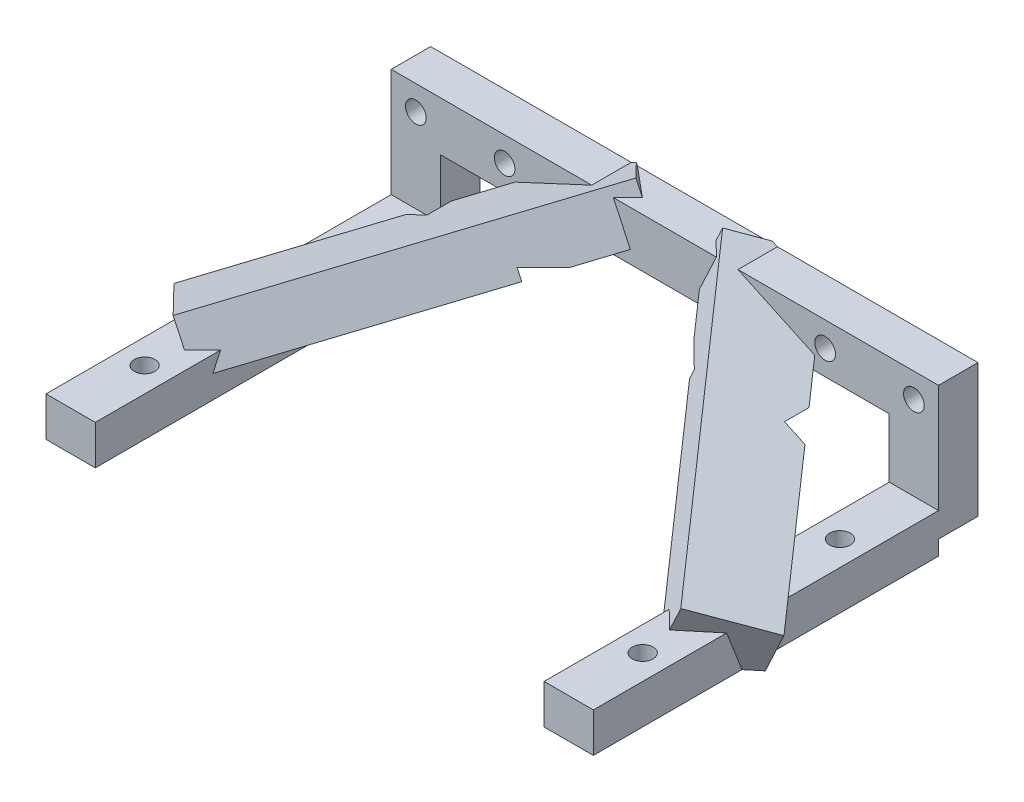
from build123d import *

# Parameters (mm, degrees)
SKETCH_1_W          = 10
SKETCH_1_H          = 70
SKETCH_1_R          = 2.1
EXTRUDE_1_DEPTH     = 8
EXTRUDE_1_2_DEPTH   = 8
SKETCH_2_W          = 10
SKETCH_2_H          = 8
EXTRUDE_2_DEPTH     = 30
SKETCH_4_W          = 8
SKETCH_4_H          = 10
EXTRUDE_3_DEPTH     = 97
SKETCH_6_R          = 2.1
CUT_EXTRUDE_1_DEPTH = 101.320735643
EXTRUDE_4_DEPTH     = 10
SKETCH_11_W         = 111
SKETCH_11_H         = 6
CUT_EXTRUDE_3_DEPTH = 86.153989901
CUT_EXTRUDE_5_DEPTH = 20
SKETCH_13_W         = 8
SKETCH_13_H         = 3
CUT_EXTRUDE_7_DEPTH = 130.217721636
SKETCH_14_W         = 130
SKETCH_14_H         = 5
CUT_EXTRUDE_8_DEPTH = 105.816357447


with BuildPart() as part:
    # 草图1 → 凸台-拉伸1 (new body)
    with BuildSketch(Plane(origin=(0, 0, 0), x_dir=(1, 0, 0), z_dir=(0, 1, 0))):
        with Locations((-50.5, 0)):
            Rectangle(SKETCH_1_W, SKETCH_1_H)
        with Locations(Location((-50.5, 20, 0), (0, 0, 270))):
            Circle(SKETCH_1_R, mode=Mode.SUBTRACT)
        with Locations(Location((-50.5, -20, 0), (0, 0, 90))):
            Circle(SKETCH_1_R, mode=Mode.SUBTRACT)
    extrude(amount=EXTRUDE_1_DEPTH)



with BuildPart() as body_2:
    # 草图1 → Extrude 1 2 (new body)
    with BuildSketch(Plane(origin=(0, 0, 0), x_dir=(1, 0, 0), z_dir=(0, 1, 0))):
        with Locations((50.5, 0)):
            Rectangle(SKETCH_1_W, SKETCH_1_H)
        with Locations(Location((50.5, -20, 0), (0, 0, 270))):
            Circle(SKETCH_1_R, mode=Mode.SUBTRACT)
        with Locations(Location((50.5, 20, 0), (0, 0, 90))):
            Circle(SKETCH_1_R, mode=Mode.SUBTRACT)
    extrude(amount=EXTRUDE_1_2_DEPTH)


with BuildPart() as part_1:
    add(part.part)

    add(body_2.part)  # 凸台-拉伸2 merges body 2
    # 草图2 → 凸台-拉伸2 (add)
    with BuildSketch(Plane(origin=(0, 0, 0), x_dir=(1, 0, 0), z_dir=(0, 1, 0))):
        with Locations((-50.5, 39)):
            Rectangle(SKETCH_2_W, SKETCH_2_H)
        with Locations((50.5, 39)):
            Rectangle(SKETCH_2_W, SKETCH_2_H)
    extrude(amount=EXTRUDE_2_DEPTH)

    # 草图4 → 凸台-拉伸3 (add)
    with BuildSketch(Plane.ZY.offset(-45.5)):
        with Locations((-39, 25)):
            Rectangle(SKETCH_4_W, SKETCH_4_H)
    extrude(amount=EXTRUDE_3_DEPTH)

    # 草图6 → 切除-拉伸1 (cut, through all)
    with BuildSketch(Plane(origin=(0, 0, -43), x_dir=(-1, 0, 0), z_dir=(0, 0, -1))):
        with Locations((-50.5, 25)):
            Circle(SKETCH_6_R)
        with Locations((-32.5, 25)):
            Circle(SKETCH_6_R)
        with Locations((32.5, 25)):
            Circle(SKETCH_6_R)
        with Locations((50.5, 25)):
            Circle(SKETCH_6_R)
    extrude(amount=-CUT_EXTRUDE_1_DEPTH, mode=Mode.SUBTRACT)

    # 草图9 → 凸台-拉伸4 (add)
    with BuildSketch(Plane(origin=(-9.912643831, 21.257733297, 0), x_dir=(0, 0, 1), z_dir=(-0.4226182617407003, 0.9063077870366496, 0))):
        Polygon((13.243149515, -41.193317821), (-37.922770357, 5.903700872), (-48.463730846, -5.547935659), (2.702189027, -52.644954352), align=None)
    extrude_4 = extrude(amount=EXTRUDE_4_DEPTH)

    # 镜向2: 凸台-拉伸4 across plane
    add(extrude_4.mirror(Plane(origin=(0, 0, 0), x_dir=(0, 0, 1), z_dir=(1, 0, 0))))

    # 草图11 → 切除-拉伸3 (cut, through all)
    with BuildSketch(Plane(origin=(0, 0, 0), x_dir=(1, 0, 0), z_dir=(0, 1, 0))):
        with Locations((0, 46)):
            Rectangle(SKETCH_11_W, SKETCH_11_H)
    extrude(amount=CUT_EXTRUDE_3_DEPTH, mode=Mode.SUBTRACT)

    # 草图12 → 切除-拉伸5 (cut)
    with BuildSketch(Plane(origin=(0, 0, -43), x_dir=(-1, 0, 0), z_dir=(0, 0, -1))):
        Polygon((-45.5, 20), (-45.5, 0), (-60, 0), (-60, -5), (60, -5), (60, 0), (45.5, 0), (45.5, 20), align=None)
    extrude(amount=-CUT_EXTRUDE_5_DEPTH, mode=Mode.SUBTRACT)

    # 草图13 → 切除-拉伸7 (cut, through all)
    with BuildSketch(Plane.ZY.offset(55.5)):
        with Locations((-39, 1.5)):
            Rectangle(SKETCH_13_W, SKETCH_13_H)
    extrude(amount=-CUT_EXTRUDE_7_DEPTH, mode=Mode.SUBTRACT)

    # 草图14 → 切除-拉伸8 (cut, through all)
    with BuildSketch(Plane(origin=(0, 0, -43), x_dir=(-1, 0, 0), z_dir=(0, 0, -1))):
        with Locations((0, -2.5)):
            Rectangle(SKETCH_14_W, SKETCH_14_H)
    extrude(amount=-CUT_EXTRUDE_8_DEPTH, mode=Mode.SUBTRACT)


solid = part_1.part
